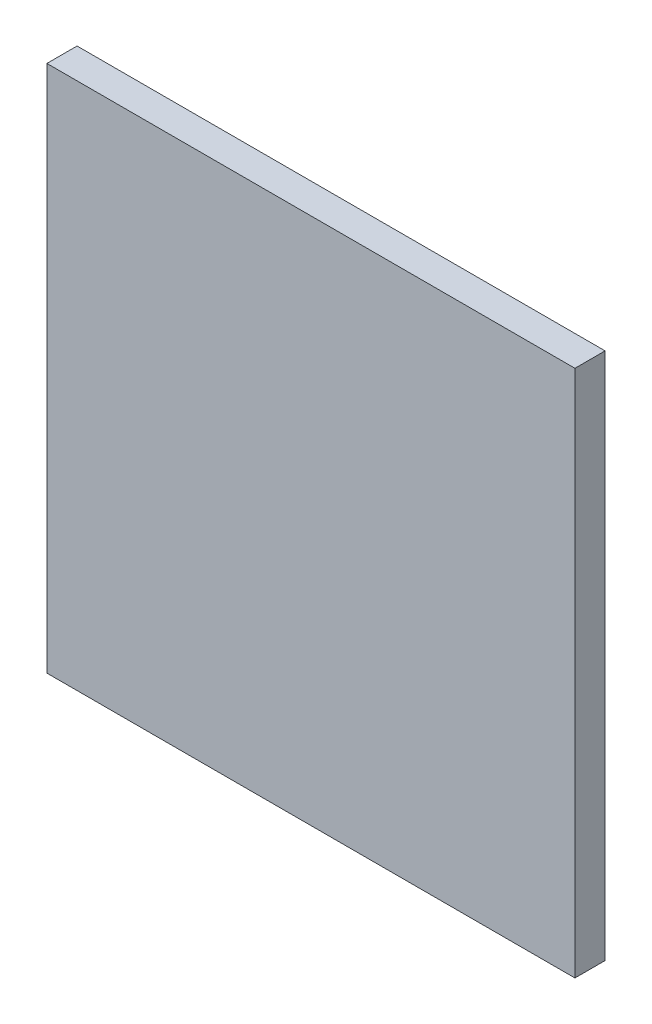
from build123d import *

# Parameters (mm, degrees)
SKETCH1_W           = 350
SKETCH1_H           = 350
BOSS_EXTRUDE1_DEPTH = 20


with BuildPart() as part:
    # Sketch1 → Boss-Extrude1 (new body)
    with BuildSketch(Plane.XY):
        with Locations((175, 175)):
            Rectangle(SKETCH1_W, SKETCH1_H)
    extrude(amount=BOSS_EXTRUDE1_DEPTH)


solid = part.part
